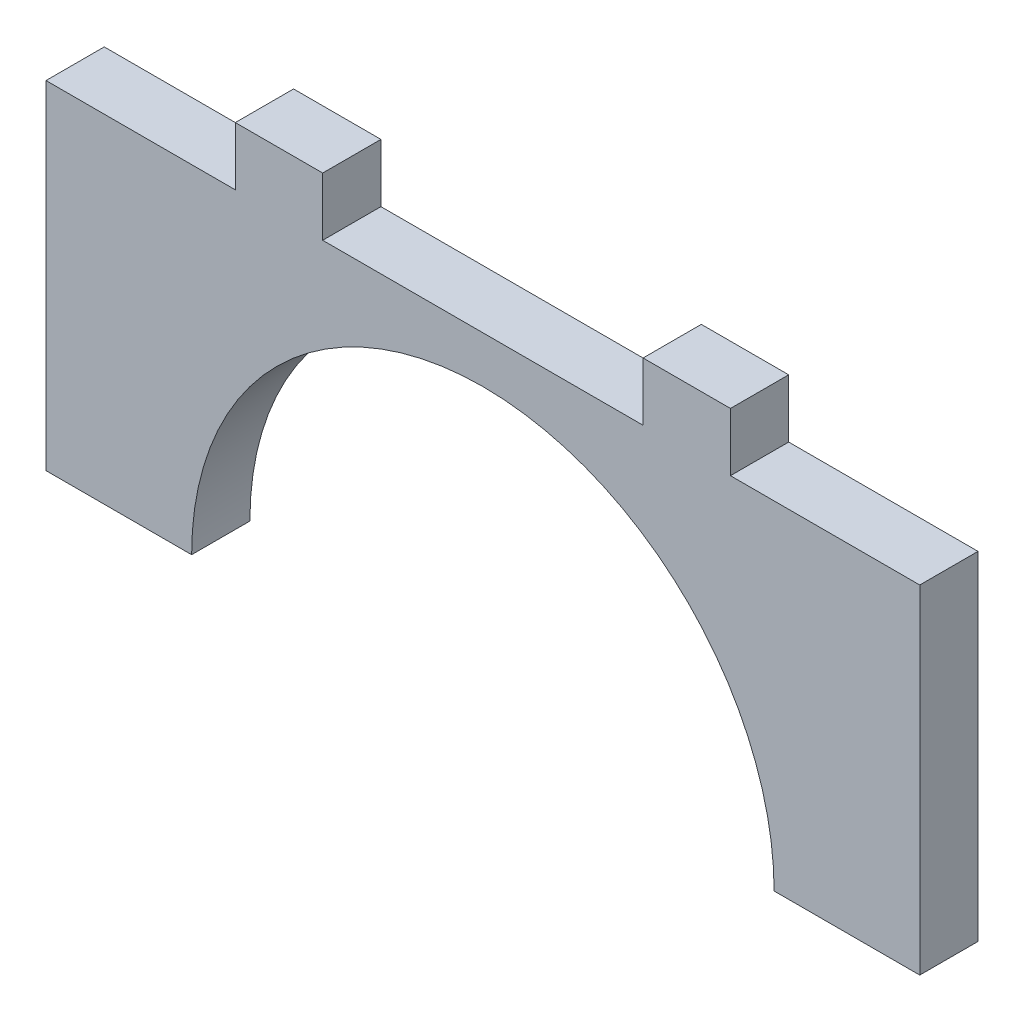
from build123d import *

# Parameters (mm, degrees)
EXTRUDE1_DEPTH = 12.7


with BuildPart() as part:
    # Sketch1 → Extrude1 (new body)
    with BuildSketch(Plane.XY):
        with BuildLine():
            Line((95.25, 142.24), (63.5, 142.24))
            ThreePointArc((63.5, 142.24), (0, 205.74), (-63.5, 142.24))
            Line((-63.5, 142.24), (-95.25, 142.24))
            Line((-95.25, 142.24), (-95.25, 215.9))
            Line((-95.25, 215.9), (-53.975, 215.9))
            Line((-53.975, 215.9), (-53.975, 228.6))
            Line((-53.975, 228.6), (-34.925, 228.6))
            Line((-34.925, 228.6), (-34.925, 215.9))
            Line((-34.925, 215.9), (34.925, 215.9))
            Line((34.925, 215.9), (34.925, 228.6))
            Line((34.925, 228.6), (53.975, 228.6))
            Line((53.975, 228.6), (53.975, 215.9))
            Line((53.975, 215.9), (95.25, 215.9))
            Line((95.25, 215.9), (95.25, 142.24))
        make_face()
    extrude(amount=-EXTRUDE1_DEPTH)


solid = part.part
